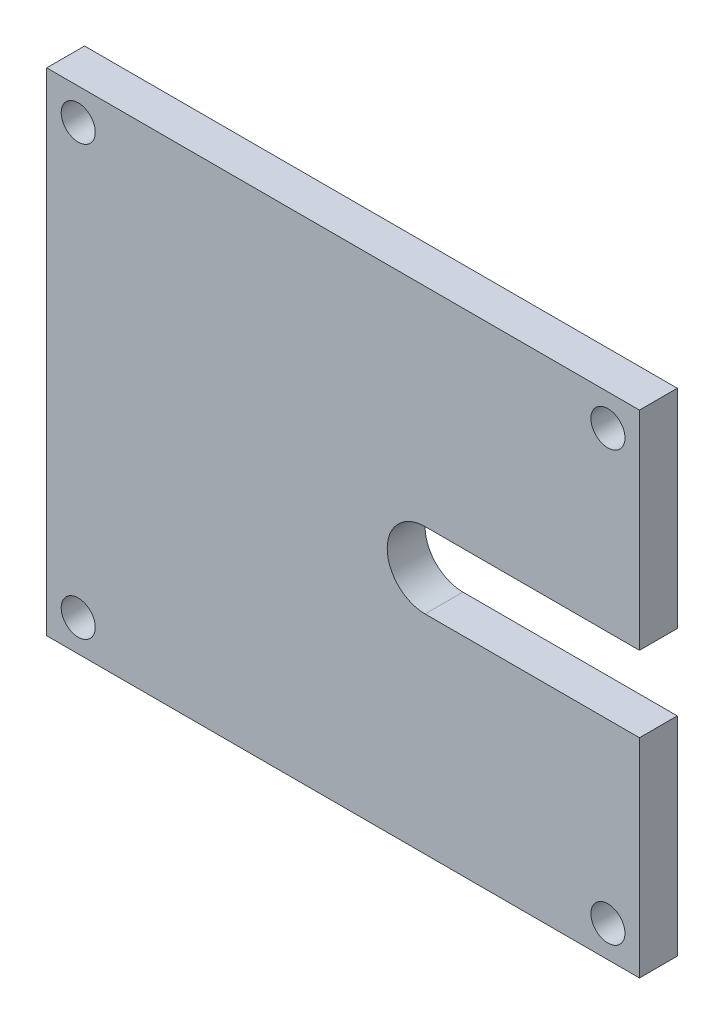
from build123d import *

# Parameters (mm, degrees)
SKETCH_1_W           = 47
SKETCH_1_H           = 39
EXTRUDE_1_DEPTH      = 3
HOLE_WIZARD_M2_5_1_D = 2.7
CUT_EXTRUDE_1_REACH  = 32.684


with BuildPart() as part:
    # 草图1 → 凸台-拉伸1 (new body)
    with BuildSketch(Plane.XY):
        Rectangle(SKETCH_1_W, SKETCH_1_H)
    extrude(amount=EXTRUDE_1_DEPTH)

    # M2.5 间隙孔1 (through all)
    with Locations(Plane.XY.offset(3)):
        with Locations((-21, -17), (21, 17), (21, -17), (-21, 17)):
            Hole(HOLE_WIZARD_M2_5_1_D / 2)

    # 草图5 → 切除-拉伸1 (cut, up to next)
    with BuildSketch(Plane.XY.offset(3), mode=Mode.PRIVATE) as cut_extrude_1_sk1:
        with BuildLine():
            Line((6.5, 3), (23.5, 3))
            ThreePointArc((23.5, 3), (26.5, 0), (23.5, -3))
            Line((23.5, -3), (6.5, -3))
            ThreePointArc((6.5, -3), (3.5, 0), (6.5, 3))
        make_face()
    cut_extrude_1_tool1 = extrude(cut_extrude_1_sk1.sketch, amount=-CUT_EXTRUDE_1_REACH, mode=Mode.PRIVATE) & part.part
    add(cut_extrude_1_tool1.solids().sort_by_distance((15, 0, 3))[0], mode=Mode.SUBTRACT)


solid = part.part
